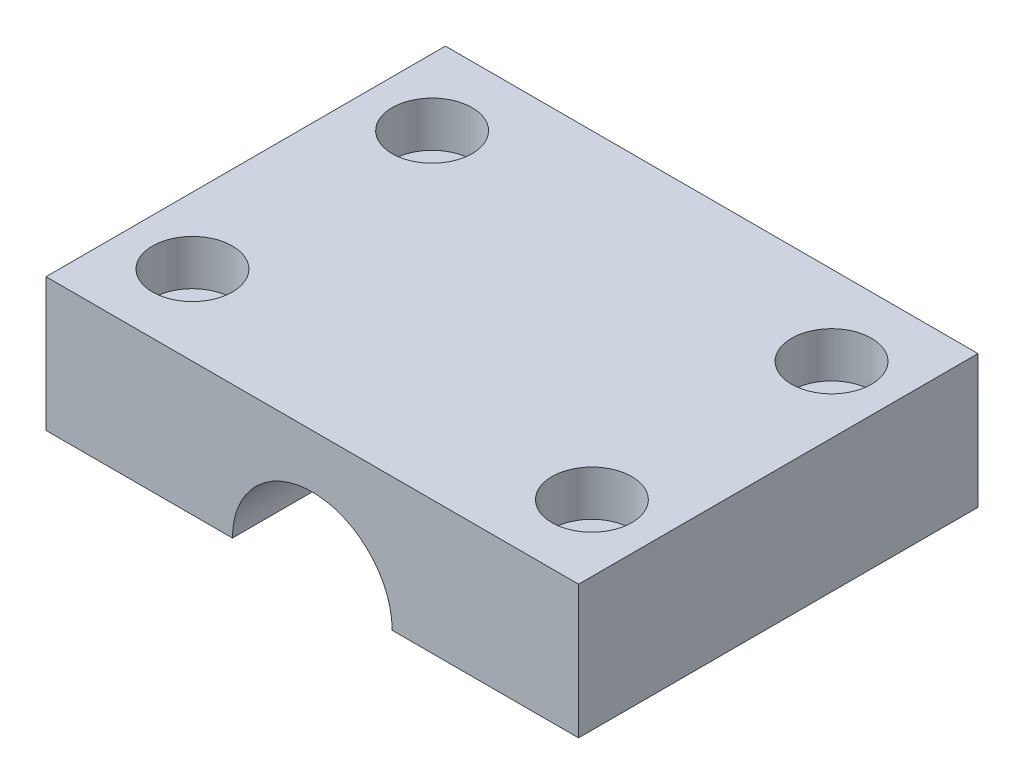
from build123d import *

# Parameters (mm, degrees)
SKETCH_1_W                   = 40
SKETCH_1_H                   = 30
EXTRUDE_1_DEPTH              = 10
CUT_EXTRUDE_1_DEPTH          = 51.990195136
HOLE_WIZARD_M3_1_D           = 3.2
HOLE_WIZARD_M3_1_CBORE_D     = 6
HOLE_WIZARD_M3_1_CBORE_DEPTH = 3.4


with BuildPart() as part:
    # 草图1 → 凸台-拉伸1 (new body)
    with BuildSketch(Plane(origin=(0, 0, 0), x_dir=(1, 0, 0), z_dir=(0, 1, 0))):
        with Locations((20, 15)):
            Rectangle(SKETCH_1_W, SKETCH_1_H)
    extrude(amount=EXTRUDE_1_DEPTH)

    # 草图2 → 切除-拉伸1 (cut, through all)
    with BuildSketch(Plane.XY):
        with BuildLine():
            Line((14, 0), (26, 0))
            ThreePointArc((26, 0), (20, 6), (14, 0))
        make_face()
    extrude(amount=-CUT_EXTRUDE_1_DEPTH, mode=Mode.SUBTRACT)

    # M3 六角圆柱头螺钉的柱形沉头孔1 (through all)
    with Locations(Plane(origin=(0, 10, 0), x_dir=(-1, 0, 0), z_dir=(0, 1, 0))):
        with Locations((-35, -24), (-5, -24), (-5, -6), (-35, -6)):
            CounterBoreHole(HOLE_WIZARD_M3_1_D / 2, HOLE_WIZARD_M3_1_CBORE_D / 2, HOLE_WIZARD_M3_1_CBORE_DEPTH)


solid = part.part
